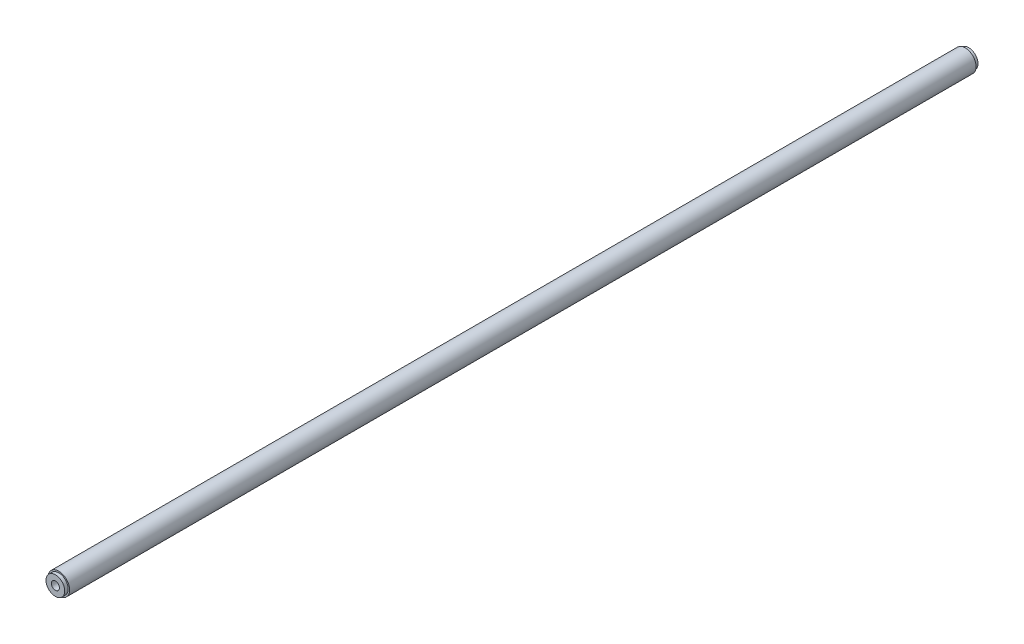
from build123d import *

# Parameters (mm, degrees)
SKETCH1_R               = 6.35
BOSS_EXTRUDE1_DEPTH     = 531
SKETCH2_R               = 5.5
BOSS_EXTRUDE2_DEPTH     = 2
BOSS_EXTRUDE3_START     = 2
SKETCH3_R               = 5.5
BOSS_EXTRUDE3_DEPTH     = 2
CUT_EXTRUDE1_DEPTH      = 536.075363851
CUT_EXTRUDE1_DEPTH_BACK = 536.075363851
SKETCH4_R               = 2.375


with BuildPart() as part:
    # Sketch1 → Boss-Extrude1 (new body)
    with BuildSketch(Plane.XY):
        Circle(SKETCH1_R)
    extrude(amount=BOSS_EXTRUDE1_DEPTH)

    # Sketch2 → Boss-Extrude2 (add)
    with BuildSketch(Plane.XY.offset(531)):
        Circle(SKETCH2_R)
    extrude(amount=BOSS_EXTRUDE2_DEPTH)

    # Sketch3 → Boss-Extrude3 (add)
    with BuildSketch(Plane(origin=(0, 0, 0), x_dir=(-1, 0, 0), z_dir=(0, 0, -1)).offset(BOSS_EXTRUDE3_START)):
        with Locations(Location((0, 0, 0), (0, 0, 180))):
            Circle(SKETCH3_R)
    extrude(amount=-BOSS_EXTRUDE3_DEPTH)

    # Sketch4 → Cut-Extrude1 (cut, two sides: drawn at the far end of the back side and taken through both)
    with BuildSketch(Plane(origin=(0, 0, -2), x_dir=(-1, 0, 0), z_dir=(0, 0, -1)).offset(-CUT_EXTRUDE1_DEPTH_BACK)):
        Circle(SKETCH4_R)
    extrude(amount=CUT_EXTRUDE1_DEPTH + CUT_EXTRUDE1_DEPTH_BACK, mode=Mode.SUBTRACT)


solid = part.part
